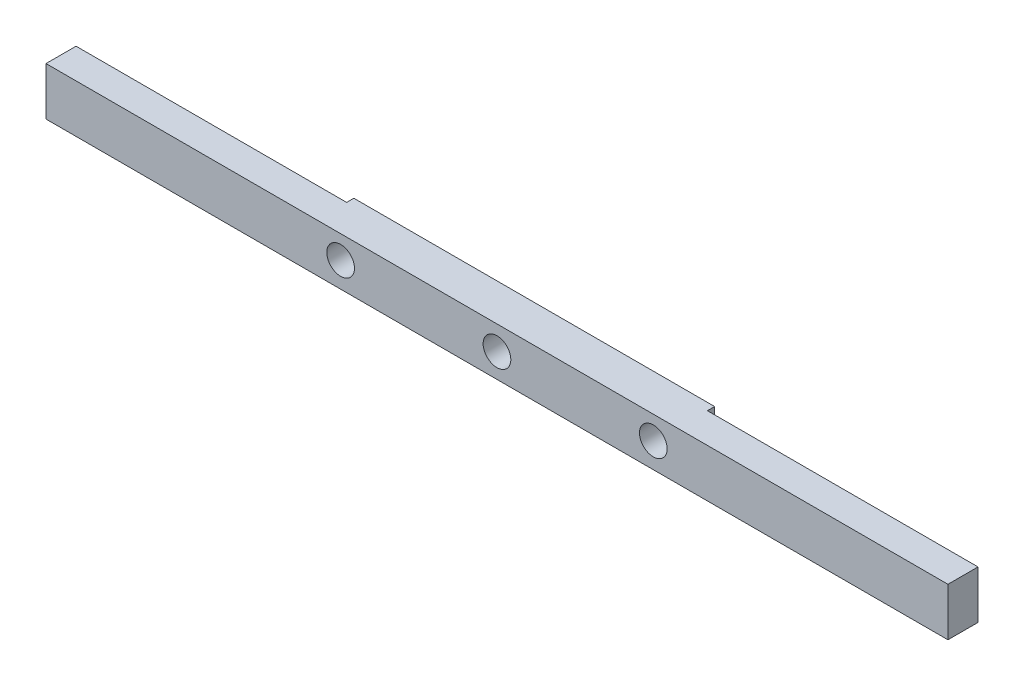
from build123d import *

# Parameters (mm, degrees)
SKETCH1_W           = 75
SKETCH1_H           = 4
BOSS_EXTRUDE1_DEPTH = 2.5
SKETCH2_R           = 1.15
CUT_EXTRUDE1_DEPTH  = 3
SKETCH3_W           = 30
SKETCH3_H           = 4
BOSS_EXTRUDE2_DEPTH = 0.6
SKETCH2_2_R         = 1.15
CUT_EXTRUDE2_DEPTH  = 76.148186938
SKETCH4_R           = 1.15
CUT_EXTRUDE3_DEPTH  = 76.170539442


with BuildPart() as part:
    # Sketch1 → Boss-Extrude1 (new body)
    with BuildSketch(Plane.XY):
        with Locations((37.5, 2)):
            Rectangle(SKETCH1_W, SKETCH1_H)
    extrude(amount=BOSS_EXTRUDE1_DEPTH)

    # Sketch2 → Cut-Extrude1 (cut)
    with BuildSketch(Plane(origin=(0, 0, 0), x_dir=(-1, 0, 0), z_dir=(0, 0, -1))):
        with Locations((-37.5, 2)):
            Circle(SKETCH2_R)
    extrude(amount=-CUT_EXTRUDE1_DEPTH, mode=Mode.SUBTRACT)

    # Sketch3 → Boss-Extrude2 (add)
    with BuildSketch(Plane(origin=(0, 0, 0), x_dir=(-1, 0, 0), z_dir=(0, 0, -1))):
        with Locations((-37.5, 2)):
            Rectangle(SKETCH3_W, SKETCH3_H)
    extrude(amount=BOSS_EXTRUDE2_DEPTH)

    # Sketch2<2> → Cut-Extrude2 (cut, through all)
    with BuildSketch(Plane(origin=(0, 0, 0), x_dir=(-1, 0, 0), z_dir=(0, 0, -1))):
        with Locations((-37.5, 2)):
            Circle(SKETCH2_2_R)
    extrude(amount=CUT_EXTRUDE2_DEPTH, mode=Mode.SUBTRACT)

    # Sketch4 → Cut-Extrude3 (cut, through all)
    with BuildSketch(Plane.XY.offset(2.5)):
        with Locations((24.5, 2.076531631)):
            Circle(SKETCH4_R)
        with Locations((50.5, 2.076531631)):
            Circle(SKETCH4_R)
    extrude(amount=-CUT_EXTRUDE3_DEPTH, mode=Mode.SUBTRACT)


solid = part.part
